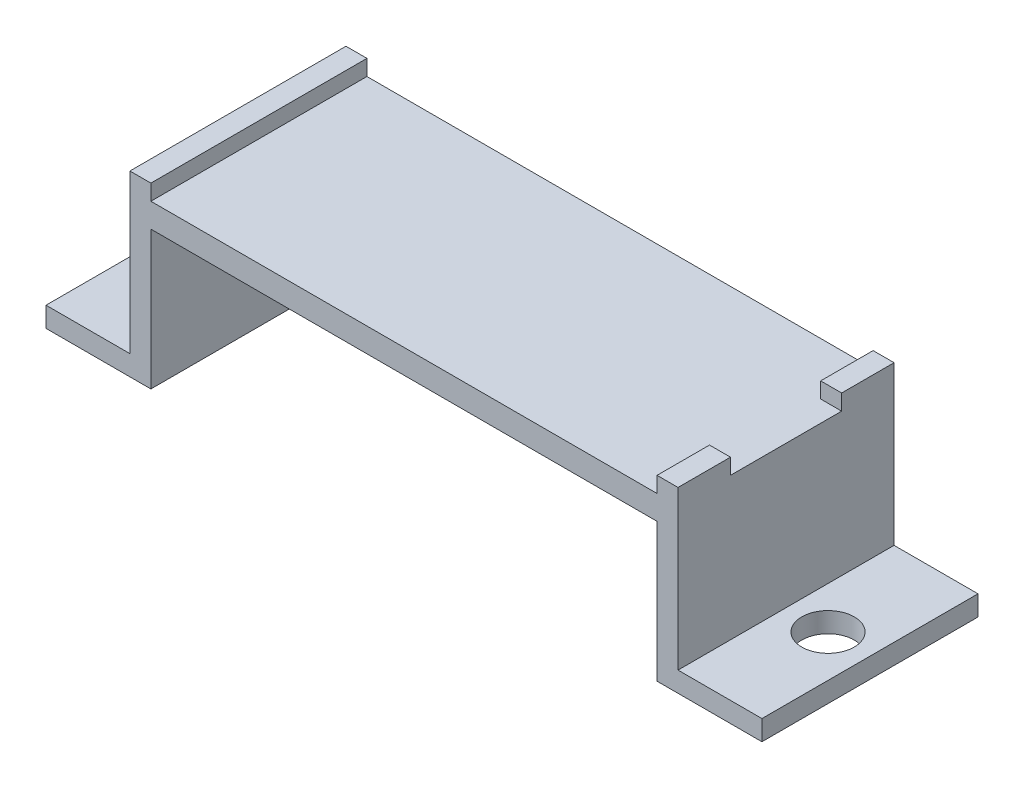
from build123d import *

# Parameters (mm, degrees)
RESSALTO_EXTRUS_O1_DEPTH = 20.6
ESBO_O2_W                = 48.26
ESBO_O2_H                = 13.2
CORTE_EXTRUS_O1_DEPTH    = 25.4
ESBO_O3_W                = 20.6
ESBO_O3_H                = 1.5
RESSALTO_EXTRUS_O2_DEPTH = 2
ESBO_O4_W                = 5
ESBO_O4_H                = 1.5
RESSALTO_EXTRUS_O3_DEPTH = 2
ESBO_O5_R                = 2.5
CORTE_EXTRUS_O2_DEPTH    = 2


with BuildPart() as part:
    # Esboço1 → Ressalto-extrusão1 (new body)
    with BuildSketch(Plane.XY):
        Polygon((35.300916774, -9.982051282), (-32.959083226, -9.982051282), (-32.959083226, -8.064102564), (-24.959083226, -8.064102564), (-24.959083226, 5.517948718), (27.300916774, 5.517948718), (27.300916774, -8.064102564), (35.300916774, -8.064102564), align=None)
    extrude(amount=RESSALTO_EXTRUS_O1_DEPTH)

    # Esboço2 → Corte-extrusão1 (cut)
    with BuildSketch(Plane.XY.offset(20.6)):
        with Locations((1.170916774, -3.382051282)):
            Rectangle(ESBO_O2_W, ESBO_O2_H)
    extrude(amount=-CORTE_EXTRUS_O1_DEPTH, mode=Mode.SUBTRACT)

    # Esboço3 → Ressalto-extrusão2 (add)
    with BuildSketch(Plane.ZY.offset(24.959083226)):
        with Locations((10.3, 6.267948718)):
            Rectangle(ESBO_O3_W, ESBO_O3_H)
    extrude(amount=-RESSALTO_EXTRUS_O2_DEPTH)

    # Esboço4 → Ressalto-extrusão3 (add)
    with BuildSketch(Plane(origin=(27.300916774, 0, 0), x_dir=(0, 0, -1), z_dir=(1, 0, 0))):
        with Locations((-18.1, 6.267948718)):
            Rectangle(ESBO_O4_W, ESBO_O4_H)
        with Locations((-2.5, 6.267948718)):
            Rectangle(ESBO_O4_W, ESBO_O4_H)
    extrude(amount=-RESSALTO_EXTRUS_O3_DEPTH)

    # Esboço5 → Corte-extrusão2 (cut)
    with BuildSketch(Plane(origin=(0, -8.064102564, 0), x_dir=(1, 0, 0), z_dir=(0, 1, 0))):
        with Locations(Location((-28.959083226, -10.3, 0), (0, 0, 180))):
            Circle(ESBO_O5_R)
        with Locations(Location((31.300916774, -10.3, 0), (0, 0, 180))):
            Circle(ESBO_O5_R)
    extrude(amount=-CORTE_EXTRUS_O2_DEPTH, mode=Mode.SUBTRACT)


solid = part.part
